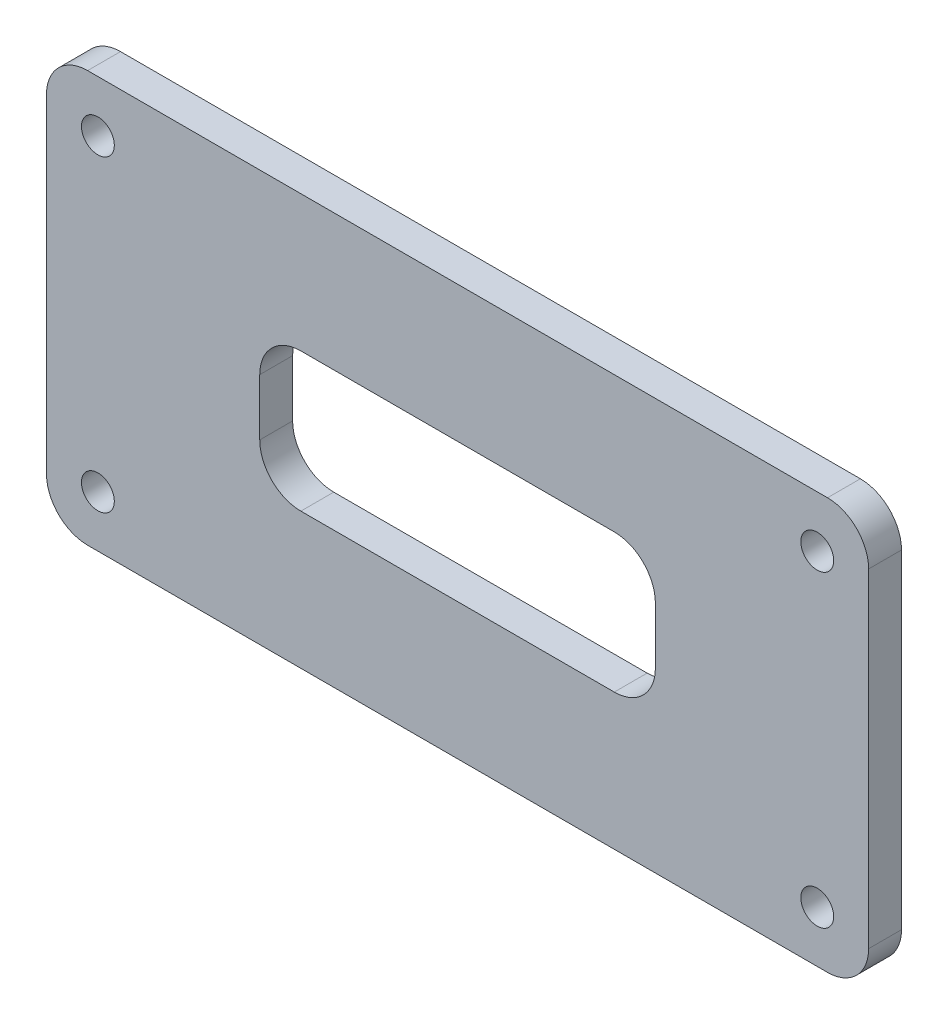
from build123d import *

# Parameters (mm, degrees)
EXTRUDE_1_DEPTH     = 3.2
CUT_EXTRUDE_1_DEPTH = 3.2
SKETCH_3_R          = 1.6
CUT_EXTRUDE_2_DEPTH = 3.2


with BuildPart() as part:
    # 草图1 → 凸台-拉伸1 (new body)
    with BuildSketch(Plane.XY):
        with BuildLine():
            Line((-36, -20), (36, -20))
            ThreePointArc((36, -20), (38.828427125, -18.828427125), (40, -16))
            Line((40, -16), (40, 16))
            ThreePointArc((40, 16), (38.828427125, 18.828427125), (36, 20))
            Line((36, 20), (-36, 20))
            ThreePointArc((-36, 20), (-38.828427125, 18.828427125), (-40, 16))
            Line((-40, 16), (-40, -16))
            ThreePointArc((-40, -16), (-38.828427125, -18.828427125), (-36, -20))
        make_face()
    extrude(amount=-EXTRUDE_1_DEPTH)

    # 草图2 → 切除-拉伸1 (cut)
    with BuildSketch(Plane.XY):
        with BuildLine():
            Line((-15.25, -6.75), (15.25, -6.75))
            ThreePointArc((15.25, -6.75), (18.078427125, -5.578427125), (19.25, -2.75))
            Line((19.25, -2.75), (19.25, 2.75))
            ThreePointArc((19.25, 2.75), (18.078427125, 5.578427125), (15.25, 6.75))
            Line((15.25, 6.75), (-15.25, 6.75))
            ThreePointArc((-15.25, 6.75), (-18.078427125, 5.578427125), (-19.25, 2.75))
            Line((-19.25, 2.75), (-19.25, -2.75))
            ThreePointArc((-19.25, -2.75), (-18.078427125, -5.578427125), (-15.25, -6.75))
        make_face()
    extrude(amount=-CUT_EXTRUDE_1_DEPTH, mode=Mode.SUBTRACT)

    # 草图3 → 切除-拉伸2 (cut)
    with BuildSketch(Plane.XY):
        with Locations((-35, 15)):
            Circle(SKETCH_3_R)
        with Locations((35, 15)):
            Circle(SKETCH_3_R)
        with Locations((35, -15)):
            Circle(SKETCH_3_R)
        with Locations((-35, -15)):
            Circle(SKETCH_3_R)
    extrude(amount=-CUT_EXTRUDE_2_DEPTH, mode=Mode.SUBTRACT)


solid = part.part
